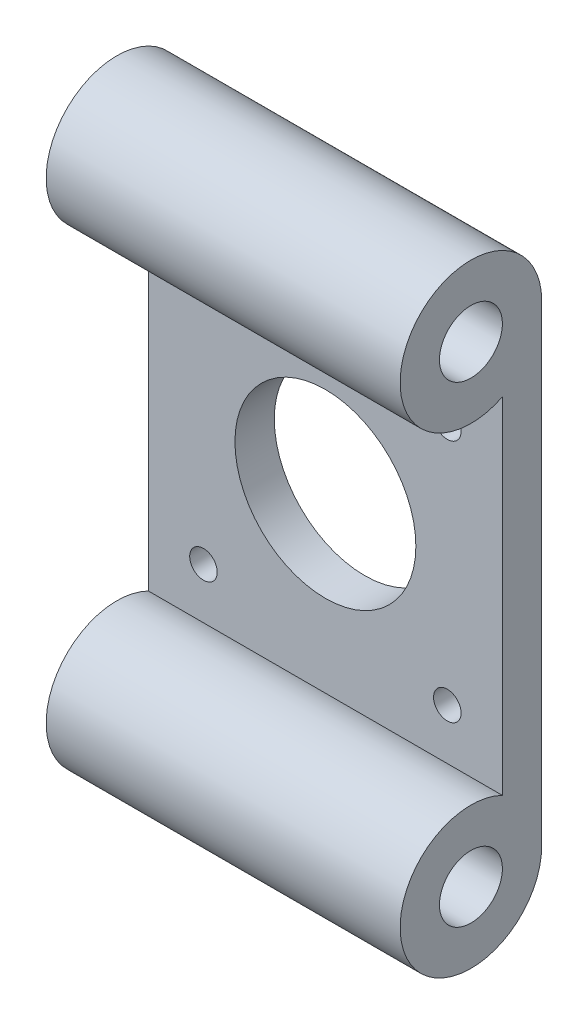
from build123d import *

# Parameters (mm, degrees)
ESBO_O1_W                = 45
ESBO_O1_H                = 45
ESBO_O1_R                = 1.75
ESBO_O1_R_2              = 11.5
RESSALTO_EXTRUS_O1_DEPTH = 5
ESBO_O3_R                = 4
RESSALTO_EXTRUS_O2_DEPTH = 45


with BuildPart() as part:
    # Esboço1 → Ressalto-extrusão1 (new body)
    with BuildSketch(Plane.XY):
        Rectangle(ESBO_O1_W, ESBO_O1_H)
        with Locations((-15.5, 15.5)):
            Circle(ESBO_O1_R, mode=Mode.SUBTRACT)
        with Locations((15.5, 15.5)):
            Circle(ESBO_O1_R, mode=Mode.SUBTRACT)
        with Locations((15.5, -15.5)):
            Circle(ESBO_O1_R, mode=Mode.SUBTRACT)
        with Locations((-15.5, -15.5)):
            Circle(ESBO_O1_R, mode=Mode.SUBTRACT)
        Circle(ESBO_O1_R_2, mode=Mode.SUBTRACT)
    extrude(amount=RESSALTO_EXTRUS_O1_DEPTH)

    # Esboço3 → Ressalto-extrusão2 (add)
    # profile 1 of 2: a face of its own
    with BuildSketch(Plane.ZY.offset(22.5)):
        with BuildLine():
            Line((0, 30), (0, 21.937742252))
            Line((0, 21.937742252), (5, 21.937742252))
            ThreePointArc((5, 21.937742252), (16.64852927, 34.74341649), (0, 30))
        make_face()
        with Locations(Location((9, 30, 0), (0, 0, 270))):
            Circle(ESBO_O3_R, mode=Mode.SUBTRACT)
    # profile 2 of 2: a face of its own
    with BuildSketch(Plane.ZY.offset(22.5)):
        with BuildLine():
            Line((5, -21.937742252), (0, -21.937742252))
            Line((0, -21.937742252), (0, -30))
            ThreePointArc((0, -30), (16.64852927, -34.74341649), (5, -21.937742252))
        make_face()
        with Locations(Location((9, -30, 0), (0, 0, 270))):
            Circle(ESBO_O3_R, mode=Mode.SUBTRACT)
    extrude(amount=-RESSALTO_EXTRUS_O2_DEPTH)


solid = part.part
